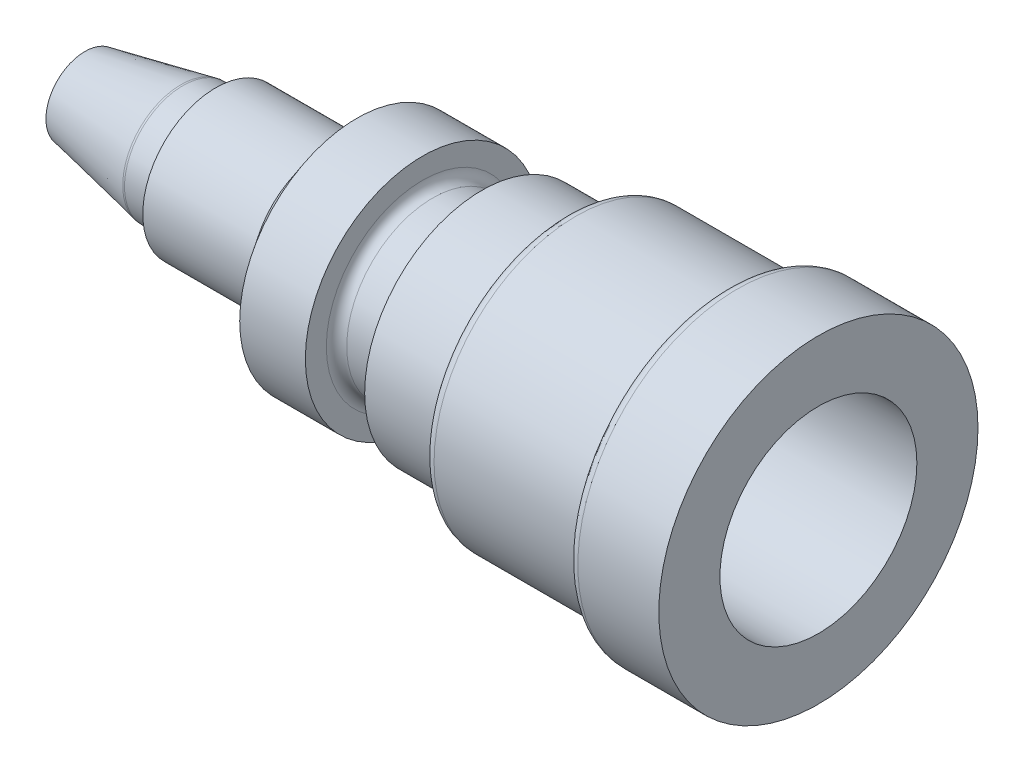
from build123d import *

# Parameters (mm, degrees)
SKETCH4_R          = 7.366
CUT_EXTRUDE1_DEPTH = 12.7
SKETCH5_R          = 1.285315945
CUT_EXTRUDE2_DEPTH = 58.402876137


with BuildPart() as part:
    # Sketch3 → Revolve1 (revolve)
    with BuildSketch(Plane(origin=(0, 0, 0), x_dir=(1, 0, 0), z_dir=(0, 1, 0))):
        with BuildLine():
            Line((-13.008224719, 5.461), (-4.908764045, 5.461))
            Line((-4.908764045, 5.461), (-2.454382022, 8.763))
            Line((-2.454382022, 8.763), (2.454382022, 8.763))
            Line((2.454382022, 8.763), (2.454382022, 7.193337079))
            ThreePointArc((2.454382022, 7.193337079), (2.677566655, 6.654521711), (3.216382022, 6.431337079))
            Line((3.216382022, 6.431337079), (6.129904719, 6.431337079))
            ThreePointArc((6.129904719, 6.431337079), (6.668720086, 6.654521711), (6.891904719, 7.193337079))
            Line((6.891904719, 7.193337079), (6.891904719, 8.763))
            Line((6.891904719, 8.763), (13.18230172, 8.763))
            Line((13.18230172, 8.763), (13.18230172, 9.861582968))
            ThreePointArc((13.18230172, 9.861582968), (13.405486353, 10.400398335), (13.94430172, 10.623582968))
            Line((13.94430172, 10.623582968), (25.249181883, 10.623582968))
            Line((25.249181883, 10.623582968), (25.249181883, 11.176))
            ThreePointArc((25.249181883, 11.176), (25.472366516, 11.714815367), (26.011181883, 11.938))
            Line((26.011181883, 11.938), (32.067699775, 11.938))
            Line((32.067699775, 11.938), (32.067699775, 0))
            Line((32.067699775, 0), (-13.008224719, 0))
            Line((-13.008224719, 0), (-22.796300225, 0))
            Line((-22.796300225, 0), (-22.796300225, 2.915805843))
            Line((-22.796300225, 2.915805843), (-15.612883129, 4.357169766))
            ThreePointArc((-15.612883129, 4.357169766), (-15.538297762, 4.368329091), (-15.462974592, 4.372061052))
            Line((-15.462974592, 4.372061052), (-13.008224719, 4.372061052))
            Line((-13.008224719, 4.372061052), (-13.008224719, 5.461))
        make_face()
    revolve(axis=Axis((32.067699775, 0, 0), (-1, 0, 0)))

    # Sketch4 → Cut-Extrude1 (cut)
    with BuildSketch(Plane(origin=(32.067699775, 0, 0), x_dir=(0, 0, -1), z_dir=(1, 0, 0))):
        Circle(SKETCH4_R)
    extrude(amount=-CUT_EXTRUDE1_DEPTH, mode=Mode.SUBTRACT)

    # Sketch5 → Cut-Extrude2 (cut, through all)
    with BuildSketch(Plane.ZY.offset(22.796300225)):
        Circle(SKETCH5_R)
    extrude(amount=-CUT_EXTRUDE2_DEPTH, mode=Mode.SUBTRACT)


solid = part.part
